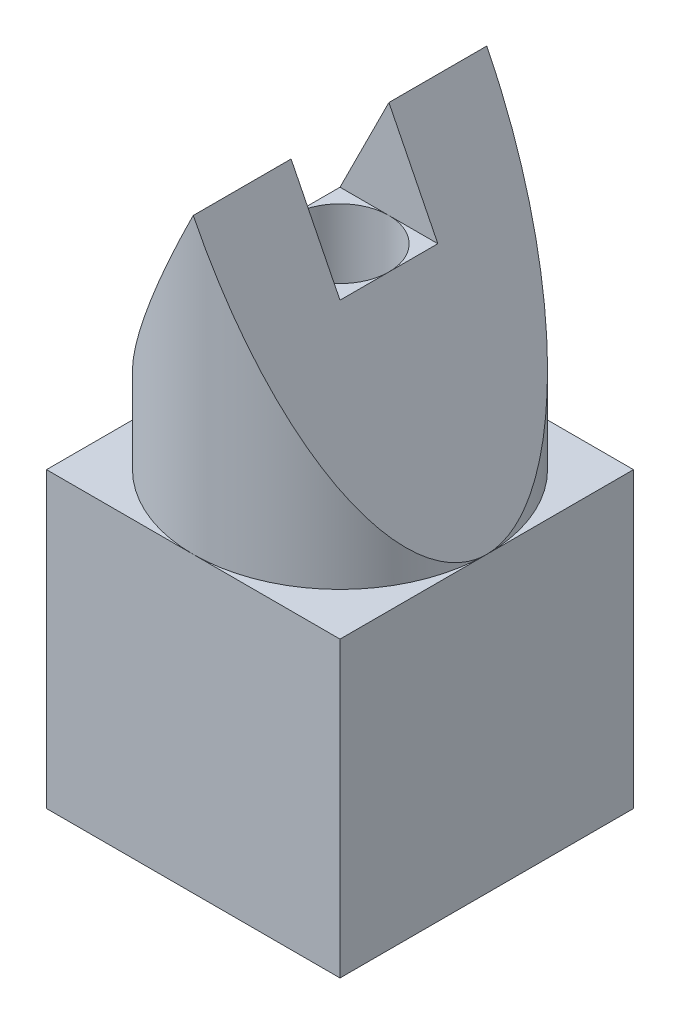
from build123d import *

# Parameters (mm, degrees)
SKETCH1_W               = 60
SKETCH1_H               = 60
BOSS_EXTRUDE1_DEPTH     = 60
SKETCH1_3_R             = 30
BOSS_EXTRUDE2_DEPTH     = 120
CUT_EXTRUDE1_START      = 120
SKETCH1_4_W             = 20
SKETCH1_4_H             = 20
CUT_EXTRUDE1_DEPTH      = 20
SKETCH1_5_R             = 10
CUT_EXTRUDE2_DEPTH      = 128.279220614
CUT_EXTRUDE3_DEPTH      = 138.477270849
CUT_EXTRUDE3_DEPTH_BACK = 138.477270849


with BuildPart() as part:
    # Sketch1 → Boss-Extrude1 (new body)
    with BuildSketch(Plane(origin=(0, 0, 0), x_dir=(1, 0, 0), z_dir=(0, 1, 0))):
        Rectangle(SKETCH1_W, SKETCH1_H)
    extrude(amount=BOSS_EXTRUDE1_DEPTH)

    # Sketch1<3> → Boss-Extrude2 (add)
    with BuildSketch(Plane(origin=(0, 0, 0), x_dir=(1, 0, 0), z_dir=(0, 1, 0))):
        with Locations(Location((0, 0, 0), (0, 0, 270))):
            Circle(SKETCH1_3_R)
    extrude(amount=BOSS_EXTRUDE2_DEPTH)

    # Sketch1<4> → Cut-Extrude1 (cut)
    with BuildSketch(Plane(origin=(0, 0, 0), x_dir=(1, 0, 0), z_dir=(0, 1, 0)).offset(CUT_EXTRUDE1_START)):
        Rectangle(SKETCH1_4_W, SKETCH1_4_H)
    extrude(amount=-CUT_EXTRUDE1_DEPTH, mode=Mode.SUBTRACT)

    # Sketch1<5> → Cut-Extrude2 (cut, through all)
    with BuildSketch(Plane(origin=(0, 0, 0), x_dir=(1, 0, 0), z_dir=(0, 1, 0))):
        with Locations(Location((0, 0, 0), (0, 0, 270))):
            Circle(SKETCH1_5_R)
    extrude(amount=CUT_EXTRUDE2_DEPTH, mode=Mode.SUBTRACT)

    # Sketch2 → Cut-Extrude3 (cut, two sides: drawn at the far end of the back side and taken through both)
    with BuildSketch(Plane.XY.offset(30).offset(-CUT_EXTRUDE3_DEPTH_BACK)):
        Polygon((-110.366799799, -100.733599598), (-30, 60), (0, 120), (30, 60), (110.366799799, -100.733599598), (110.366799799, 258.677655371), (-110.366799799, 258.677655371), align=None)
    extrude(amount=CUT_EXTRUDE3_DEPTH + CUT_EXTRUDE3_DEPTH_BACK, mode=Mode.SUBTRACT)


solid = part.part
